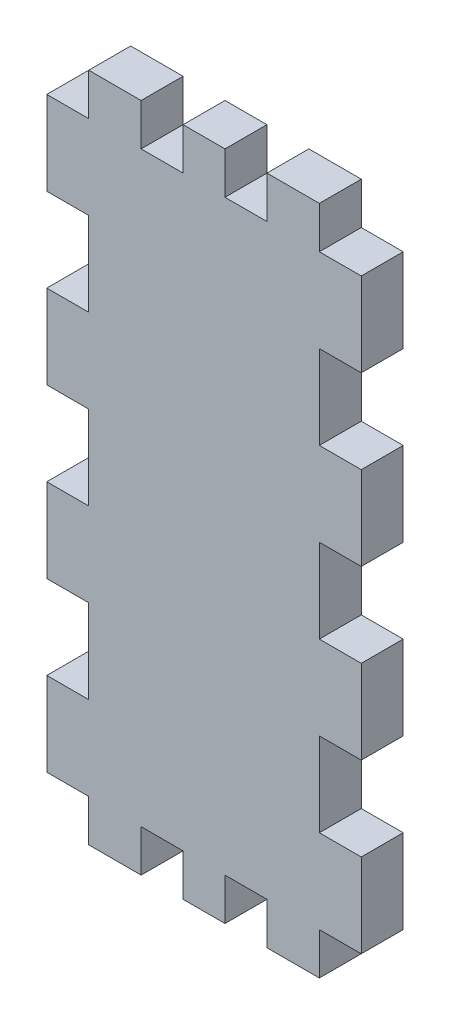
from build123d import *

# Parameters (mm, degrees)
SKETCH1_W           = 47.625
SKETCH1_H           = 101.6
BOSS_EXTRUDE1_DEPTH = 6.35
SKETCH4_W           = 12.7
SKETCH4_H           = 12.7
CUT_EXTRUDE1_DEPTH  = 177.991271514
LPATTERN1_COUNT     = 3
LPATTERN1_PITCH     = 25.4
LPATTERN1_COL_COUNT = 3
LPATTERN1_COL_PITCH = 25.4
SKETCH3_W           = 6.35
SKETCH3_H           = 12.7
CUT_EXTRUDE2_DEPTH  = 177.991271514


with BuildPart() as part:
    # Sketch1 → Boss-Extrude1 (new body)
    with BuildSketch(Plane.XY):
        with Locations((-23.8125, -119.54508231)):
            Rectangle(SKETCH1_W, SKETCH1_H)
    extrude(amount=-BOSS_EXTRUDE1_DEPTH)

    # Sketch4 → Cut-Extrude1 (cut, through all)
    with BuildSketch(Plane.XY):
        with Locations((0, -119.54508231)):
            Rectangle(SKETCH4_W, SKETCH4_H)
        with Locations((-47.625, -119.54508231)):
            Rectangle(SKETCH4_W, SKETCH4_H)
    cut_extrude1 = extrude(amount=-CUT_EXTRUDE1_DEPTH, mode=Mode.SUBTRACT)

    # LPattern1: Cut-Extrude1 ×3
    with Locations(*[(0, -i * LPATTERN1_PITCH, 0) for i in range(1, LPATTERN1_COUNT)]):
        add(cut_extrude1, mode=Mode.SUBTRACT)

    # LPattern1 col: Cut-Extrude1 ×3
    with Locations(*[(0, i * LPATTERN1_COL_PITCH, 0) for i in range(1, LPATTERN1_COL_COUNT)]):
        add(cut_extrude1, mode=Mode.SUBTRACT)

    # Sketch3 → Cut-Extrude2 (cut, through all)
    with BuildSketch(Plane.XY):
        with Locations((-17.4625, -68.74508231)):
            Rectangle(SKETCH3_W, SKETCH3_H)
        with Locations((-30.1625, -68.74508231)):
            Rectangle(SKETCH3_W, SKETCH3_H)
        with Locations((-30.1625, -170.34508231)):
            Rectangle(SKETCH3_W, SKETCH3_H)
        with Locations((-17.4625, -170.34508231)):
            Rectangle(SKETCH3_W, SKETCH3_H)
    extrude(amount=-CUT_EXTRUDE2_DEPTH, mode=Mode.SUBTRACT)


solid = part.part
